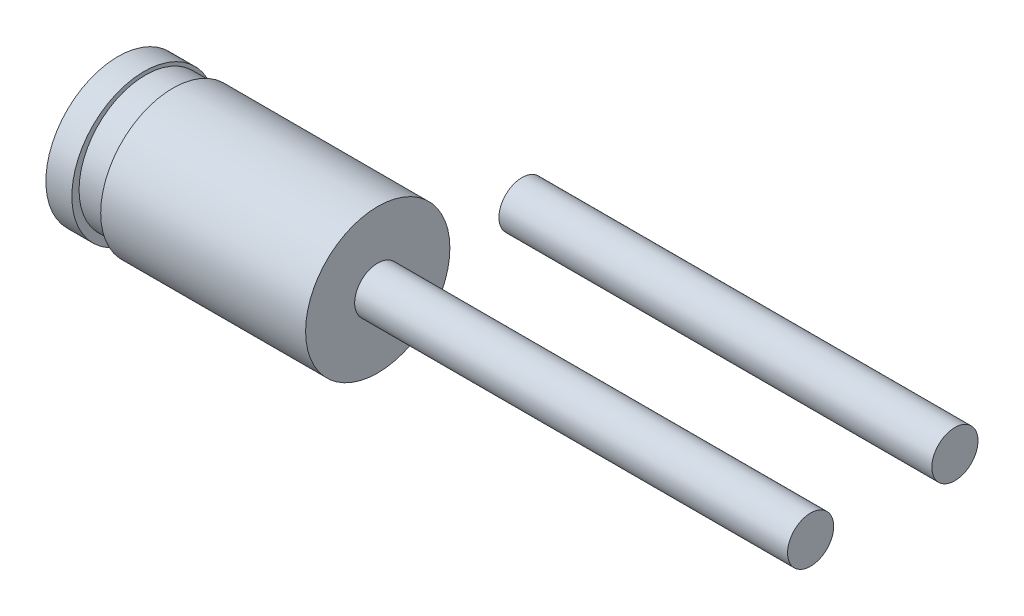
from build123d import *

# Parameters (mm, degrees)
SKETCH_3_R      = 1.25
EXTRUDE_1_DEPTH = 4.5
SKETCH_4_W      = 0.5
SKETCH_4_H      = 0.5
SKETCH_7_R      = 0.4
EXTRUDE_3_DEPTH = 7.5
SKETCH_10_R     = 0.4
EXTRUDE_4_DEPTH = 7.5


with BuildPart() as part:
    # Эскиз3 → Вытянуть1 (new body)
    with BuildSketch(Plane(origin=(2.95, 0, 0), x_dir=(0, 0, -1), z_dir=(1, 0, 0))):
        with Locations((-1.525, -0.033649265)):
            Circle(SKETCH_3_R)
    extrude(amount=EXTRUDE_1_DEPTH)

    # Эскиз4 → Вырез-Повернуть1 (revolve, cut)
    with BuildSketch(Plane(origin=(0, 0, 0), x_dir=(1, 0, 0), z_dir=(0, 1, 0)), mode=Mode.PRIVATE) as cut_revolve_1_sk:
        with Locations((3.65, -0.1)):
            Rectangle(SKETCH_4_W, SKETCH_4_H)
    revolve(cut_revolve_1_sk.sketch.rotate(Axis((0, 0, 1.5), (1, 0, 0)), 180), axis=Axis((0, 0, 1.5), (1, 0, 0)), mode=Mode.SUBTRACT)

    # Эскиз7 → Вытянуть3 (add)
    with BuildSketch(Plane(origin=(7.45, 0, 0), x_dir=(0, 0, -1), z_dir=(1, 0, 0))):
        with Locations((-1.525, -0.033649265)):
            Circle(SKETCH_7_R)
    extrude(amount=EXTRUDE_3_DEPTH)


with BuildPart() as body_2:
    # Эскиз10 → Вытянуть4 (new body)
    with BuildSketch(Plane(origin=(14.95, 0, 0), x_dir=(0, 0, -1), z_dir=(1, 0, 0))):
        with Locations((0.975, 0)):
            Circle(SKETCH_10_R)
    extrude(amount=-EXTRUDE_4_DEPTH)


solid = Compound([part.part, body_2.part])
